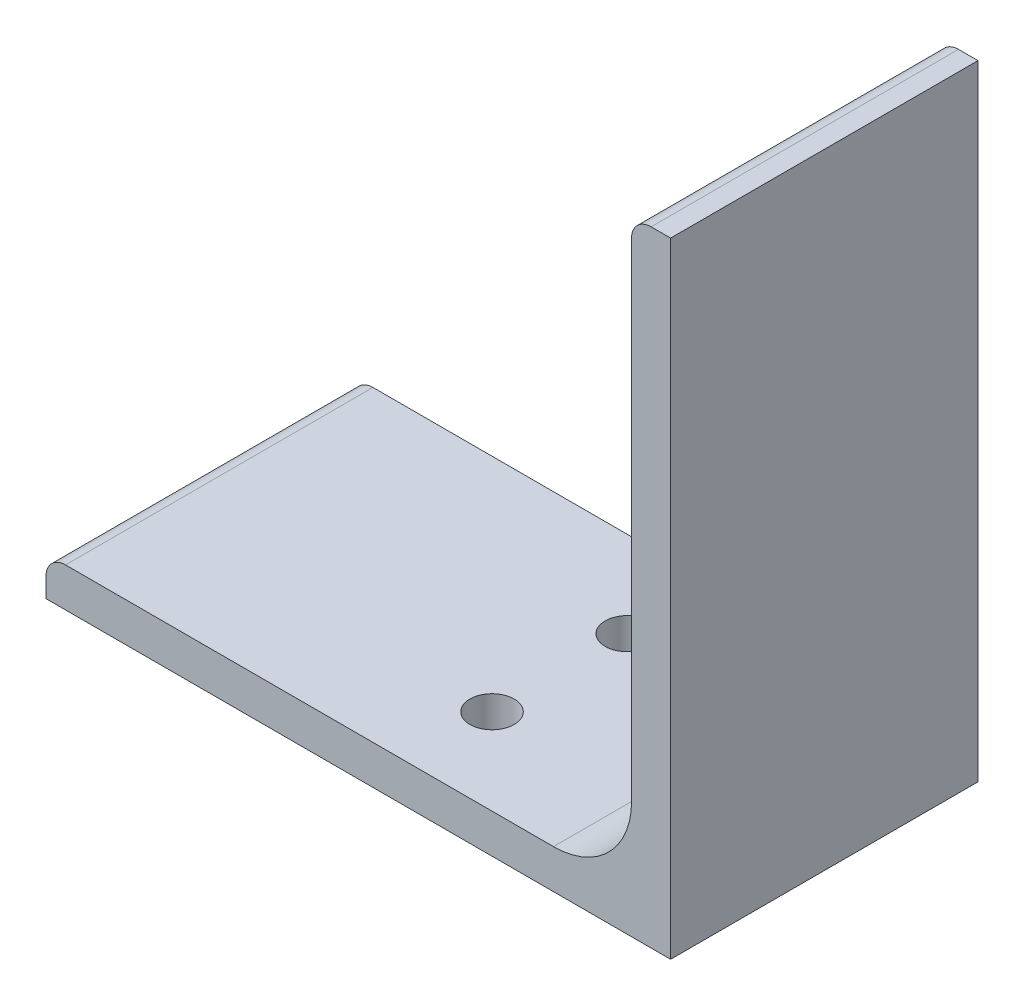
from build123d import *

# Parameters (mm, degrees)
BOSS_EXTRUDE1_DEPTH  = 12.500000019
M3_CLEARANCE_HOLE1_D = 3.6


with BuildPart() as part:
    # Sketch2 → Boss-Extrude1 (new, symmetric)
    with BuildSketch(Plane.XY):
        with BuildLine():
            Line((-25.4, -25.4), (25.4, -25.4))
            Line((25.4, -25.4), (25.4, 25.4))
            Line((25.4, 25.4), (23.8125, 25.4))
            ThreePointArc((23.8125, 25.4), (22.689967985, 24.935032015), (22.225, 23.8125))
            Line((22.225, 23.8125), (22.225, -15.875))
            ThreePointArc((22.225, -15.875), (20.365128061, -20.365128061), (15.875, -22.225))
            Line((15.875, -22.225), (-23.8125, -22.225))
            ThreePointArc((-23.8125, -22.225), (-24.935032015, -22.689967985), (-25.4, -23.8125))
            Line((-25.4, -23.8125), (-25.4, -25.4))
        make_face()
    extrude(amount=BOSS_EXTRUDE1_DEPTH, both=True)

    # M3 Clearance Hole1 (through all)
    with Locations(Plane(origin=(0, -22.225, 0), x_dir=(1, 0, 0), z_dir=(0, 1, 0))):
        with Locations((3.875000124, 5.500000049), (3.875000124, -5.500000049)):
            Hole(M3_CLEARANCE_HOLE1_D / 2)


solid = part.part
